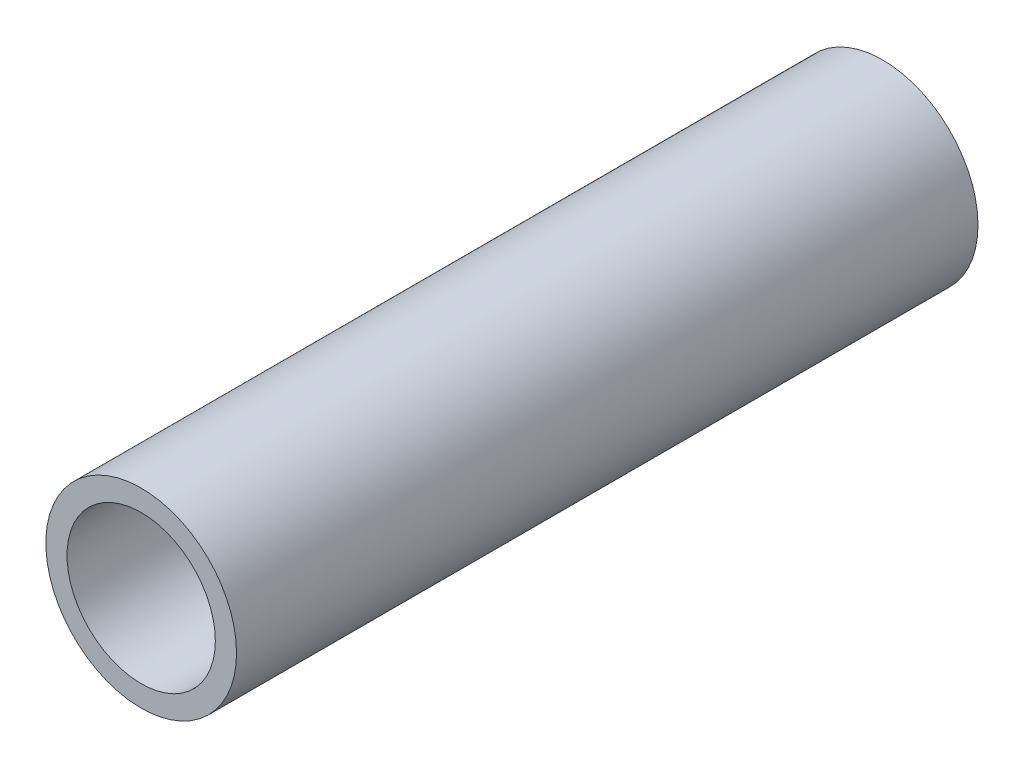
from build123d import *

# Parameters (mm, degrees)
SKETCH_1_W = 2
SKETCH_1_H = 70


with BuildPart() as part:
    # 草图1 → 旋转1 (revolve)
    with BuildSketch(Plane(origin=(0, 0, 0), x_dir=(1, 0, 0), z_dir=(0, 1, 0))):
        with Locations((8, -35)):
            Rectangle(SKETCH_1_W, SKETCH_1_H)
    revolve(axis=Axis((0, 0, 0), (0, 0, 1)))


solid = part.part
